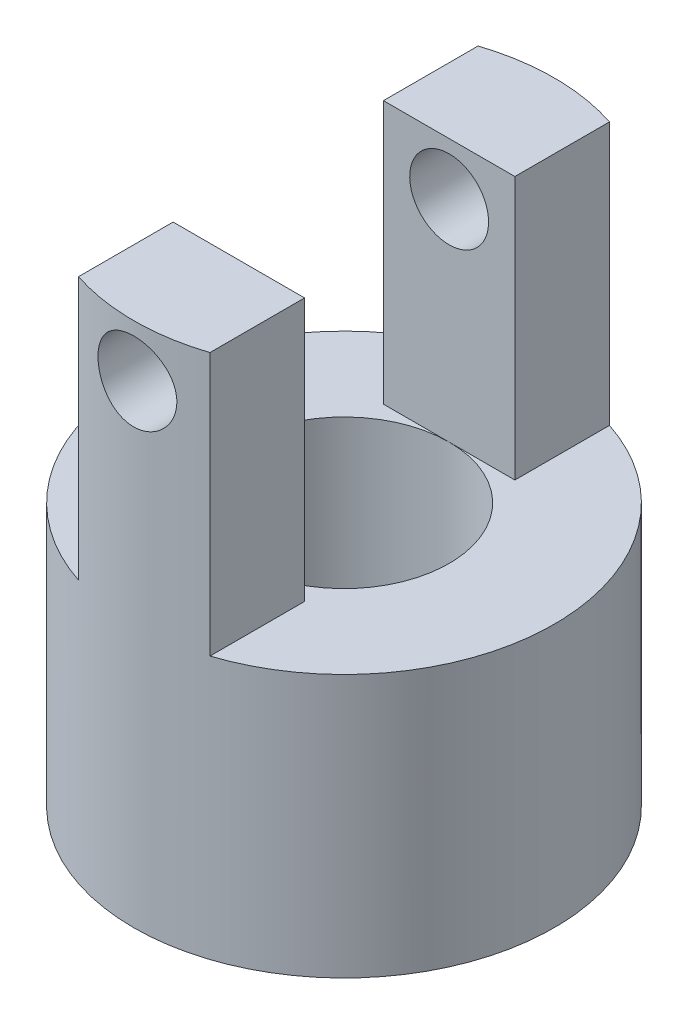
from build123d import *

# Parameters (mm, degrees)
SKETCH_1_R               = 8
EXTRUDE_1_DEPTH          = 20
CUT_EXTRUDE_1_DEPTH      = 23.978250586
CUT_EXTRUDE_1_DEPTH_BACK = 23.978250586
SKETCH_2_W               = 5.5
SKETCH_2_H               = 10
CUT_EXTRUDE_2_DEPTH      = 24.963513933
CUT_EXTRUDE_2_DEPTH_BACK = 24.963513933
SKETCH_3_W               = 8
SKETCH_3_H               = 10
CUT_EXTRUDE_3_DEPTH      = 23.978250586
CUT_EXTRUDE_3_DEPTH_BACK = 23.978250586
SKETCH_4_R               = 1.5
CUT_EXTRUDE_4_DEPTH      = 23.978250743
CUT_EXTRUDE_4_DEPTH_BACK = 23.978250743
SKETCH_5_R               = 4


with BuildPart() as part:
    # 草图1 → 凸台-拉伸1 (new body)
    with BuildSketch(Plane(origin=(0, 0, 0), x_dir=(1, 0, 0), z_dir=(0, 1, 0))):
        with Locations(Location((0, 0, 0), (0, 0, 270))):
            Circle(SKETCH_1_R)
    extrude(amount=EXTRUDE_1_DEPTH)

    # 草图2 → 切除-拉伸1 (cut, two sides: drawn at the far end of the back side and taken through both)
    with BuildSketch(Plane.XY.offset(-CUT_EXTRUDE_1_DEPTH_BACK)):
        with Locations((-5.25, 15)):
            Rectangle(SKETCH_2_W, SKETCH_2_H)
        with Locations((5.25, 15)):
            Rectangle(SKETCH_2_W, SKETCH_2_H)
    extrude(amount=CUT_EXTRUDE_1_DEPTH + CUT_EXTRUDE_1_DEPTH_BACK, mode=Mode.SUBTRACT)

    # 草图3 → 切除-拉伸2 (cut, two sides: drawn at the far end of the back side and taken through both)
    with BuildSketch(Plane.ZY.offset(2.5).offset(-CUT_EXTRUDE_2_DEPTH_BACK)):
        with Locations((0, 15)):
            Rectangle(SKETCH_3_W, SKETCH_3_H)
    extrude(amount=CUT_EXTRUDE_2_DEPTH + CUT_EXTRUDE_2_DEPTH_BACK, mode=Mode.SUBTRACT)

    # 草图4 → 切除-拉伸3 (cut, two sides: drawn at the far end of the back side and taken through both)
    with BuildSketch(Plane.XY.offset(-CUT_EXTRUDE_3_DEPTH_BACK)):
        with Locations((0, 18)):
            Circle(SKETCH_4_R)
    extrude(amount=CUT_EXTRUDE_3_DEPTH + CUT_EXTRUDE_3_DEPTH_BACK, mode=Mode.SUBTRACT)

    # 草图5 → 切除-拉伸4 (cut, two sides: drawn at the far end of the back side and taken through both)
    with BuildSketch(Plane.XZ.offset(-CUT_EXTRUDE_4_DEPTH_BACK)):
        with Locations(Location((0, 0, 0), (0, 0, 270))):
            Circle(SKETCH_5_R)
    extrude(amount=CUT_EXTRUDE_4_DEPTH + CUT_EXTRUDE_4_DEPTH_BACK, mode=Mode.SUBTRACT)


solid = part.part
